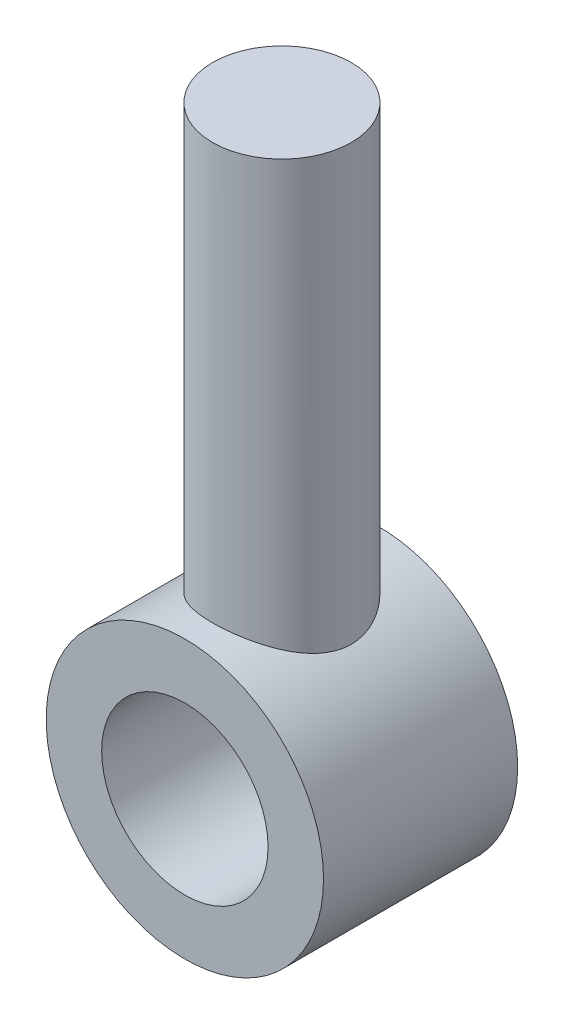
from build123d import *

# Parameters (mm, degrees)
SKETCH1_R           = 5
SKETCH1_R_2         = 3
BOSS_EXTRUDE1_DEPTH = 7
BOSS_EXTRUDE2_START = 3
SKETCH3_R           = 2.5
BOSS_EXTRUDE2_DEPTH = 17


with BuildPart() as part:
    # Sketch1 → Boss-Extrude1 (new body)
    with BuildSketch(Plane.XY):
        Circle(SKETCH1_R)
        Circle(SKETCH1_R_2, mode=Mode.SUBTRACT)
    extrude(amount=BOSS_EXTRUDE1_DEPTH)

    # Sketch3 → Boss-Extrude2 (add)
    with BuildSketch(Plane(origin=(0, 0, 0), x_dir=(1, 0, 0), z_dir=(0, 1, 0)).offset(BOSS_EXTRUDE2_START)):
        with Locations((0, -3.5)):
            Circle(SKETCH3_R)
    extrude(amount=BOSS_EXTRUDE2_DEPTH)


solid = part.part
